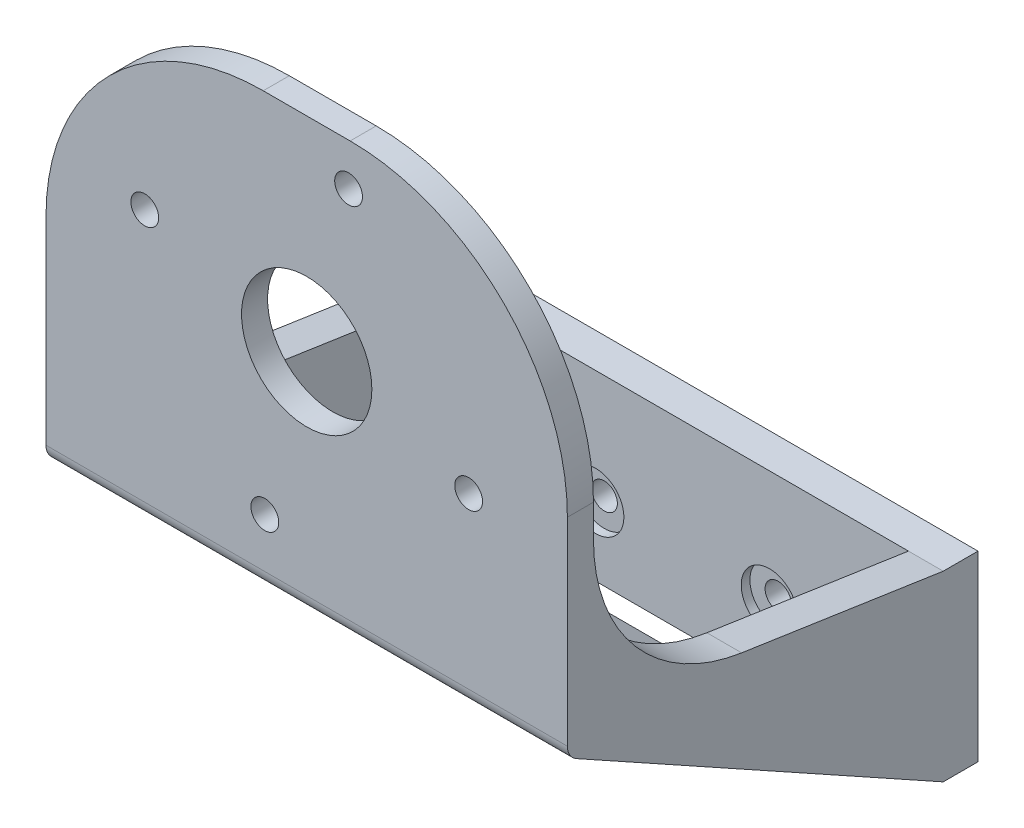
from build123d import *

# Parameters (mm, degrees)
SKETCH_1_R          = 1.4999999999999987
EXTRUDE_1_DEPTH     = 4
SKETCH_3_R          = 3.2499999999999996
SKETCH_3_R_2        = 3.249999999999999
CUT_EXTRUDE_1_DEPTH = 1
EXTRUDE_2_DEPTH     = 4
EXTRUDE_3_DEPTH     = 4
EXTRUDE_4_DEPTH     = 52
FILLET_1_R          = 25
FILLET_2_R          = 20
EXTRUDE_6_DEPTH     = 52
FILLET_4_R          = 6
FILLET_5_R          = 2
SKETCH_11_R         = 7.500000000000031
CUT_EXTRUDE_2_DEPTH = 4
FILLET_6_R          = 2


with BuildPart() as part:
    # 草图1 → 凸台-拉伸1 (new body)
    # profile 1 of 3: a face of its own
    with BuildSketch(Plane.XY):
        Polygon((30.00000000000006, 4.99999999999999), (30.000000000000057, -5.0000000000000115), (-29.99999999999994, -5.0000000000000115), (-29.999999999999936, 4.99999999999999), align=None)
        with Locations((9.999999999999996, 5.68e-15)):
            Circle(SKETCH_1_R, mode=Mode.SUBTRACT)
        with Locations((-10.000000000000004, -4.4e-16)):
            Circle(SKETCH_1_R, mode=Mode.SUBTRACT)
    # profile 2 of 3: a face of its own
    with BuildSketch(Plane.XY):
        Polygon((-30.000000000000014, 12.999999999999998), (29.999999999999986, 12.999999999999998), (30.00000000000006, 4.99999999999999), (-29.999999999999936, 4.99999999999999), align=None)
    # profile 3 of 3: a face of its own
    with BuildSketch(Plane.XY):
        Polygon((-29.99999999999994, -5.0000000000000115), (-30.000000000000018, -8.000000000000002), (29.999999999999982, -8.000000000000002), (30.000000000000057, -5.0000000000000115), align=None)
    extrude(amount=EXTRUDE_1_DEPTH)

    # 草图3 → 切除-拉伸1 (cut)
    with BuildSketch(Plane.XY.offset(4)):
        with Locations((-10.000000000000004, -4.6e-16)):
            Circle(SKETCH_3_R)
        with Locations((9.999999999999996, 5.69e-15)):
            Circle(SKETCH_3_R_2)
    extrude(amount=-CUT_EXTRUDE_1_DEPTH, mode=Mode.SUBTRACT)

    # 草图5 → 凸台-拉伸2 (add)
    with BuildSketch(Plane.ZY.offset(29.999999999999936)):
        Polygon((47.25000000000001, 15.99999999999999), (4, -8.000000000000012), (4, 12.999999999999988), (44.25, 18.99999999999999), (44.25, 64.99999999999999), (47.25, 64.99999999999999), align=None)
    extrude(amount=-EXTRUDE_2_DEPTH)

    # 草图6 → 凸台-拉伸3 (add)
    with BuildSketch(Plane(origin=(30.00000000000006, -1.041e-14, 0), x_dir=(0, 0, -1), z_dir=(1, -3.5e-16, 0))):
        Polygon((-44.25, 64.99999999999999), (-47.25, 64.99999999999999), (-47.25000000000001, 15.99999999999999), (-4, -8.00000000000001), (-4, 13.000000000000009), (-44.25, 18.999999999999993), align=None)
    extrude(amount=-EXTRUDE_3_DEPTH)

    # 草图7 → 凸台-拉伸4 (add)
    with BuildSketch(Plane(origin=(-25.999999999999932, 8.47e-15, 0), x_dir=(0, 0, -1), z_dir=(1, -3.3e-16, 0))):
        Polygon((-44.25, 14.335260115606923), (-44.25, 18.999999999999993), (-44.25, 64.99999999999999), (-47.25, 64.99999999999999), (-47.25000000000001, 15.999999999999986), align=None)
    extrude(amount=EXTRUDE_4_DEPTH)

    # 圆角1
    fillet_1_edges = [part.edges().sort_by_distance(p)[0] for p in [
        (-29.999999999999915, 65, 45.75),
        (30.00000000000008, 64.99999999999997, 45.75),
    ]]
    fillet(fillet_1_edges, radius=FILLET_1_R)

    # 圆角2
    fillet_2_edges = [part.edges().sort_by_distance(p)[0] for p in [
        (-27.99999999999993, 19, 44.25),
        (28.000000000000068, 18.999999999999982, 44.25),
    ]]
    fillet(fillet_2_edges, radius=FILLET_2_R)

    # 草图9 → 凸台-拉伸6 (add)
    with BuildSketch(Plane(origin=(-25.999999999999932, 8.47e-15, 0), x_dir=(0, 0, -1), z_dir=(1, -3.3e-16, 0))):
        Polygon((-33.14820415728187, 11.605667405253392), (-34.60384535674384, 8.982480660389633), (-17.11593372431879, -0.7217940026901655), (-17.115933724318786, 2.7091473962102923), align=None)
    extrude(amount=EXTRUDE_6_DEPTH)

    # 圆角4
    fillet_4_edges = [part.edges().sort_by_distance(p)[0] for p in [
        (-25.99999999999993, 10.294074032821522, 33.87602475701286),
        (26.00000000000007, 10.294074032821504, 33.87602475701286),
    ]]
    fillet(fillet_4_edges, radius=FILLET_4_R)

    # 圆角5
    fillet_5_edges = [part.edges().sort_by_distance(p)[0] for p in [
        (6.75e-14, -0.721794002690165, 17.11593372431879),
    ]]
    fillet(fillet_5_edges, radius=FILLET_5_R)

    # 草图11 → 切除-拉伸2 (cut)
    with BuildSketch(Plane.XY.offset(47.25000000000001)):
        with BuildLine():
            ThreePointArc((-20.11504932930021, 46.93210856983418), (-19.24913556906646, 44.8416078260319), (-17.158634825264187, 45.70752158626565))
            ThreePointArc((-17.158634825264187, 45.70752158626565), (-18.024548585497932, 47.79802233006792), (-20.11504932930021, 46.93210856983418))
        make_face()
        with BuildLine():
            ThreePointArc((-4.207521586267032, 24.341365174733916), (-6.298022330069304, 23.475451414500167), (-5.432108569835557, 21.384950670697894))
            ThreePointArc((-5.432108569835557, 21.384950670697894), (-3.341607826033282, 22.250864430931642), (-4.207521586267032, 24.341365174733916))
        make_face()
        with BuildLine():
            ThreePointArc((20.11504932930082, 36.06789143016255), (19.24913556906707, 38.158392173964835), (17.158634825264798, 37.292478413731075))
            ThreePointArc((17.158634825264798, 37.292478413731075), (18.024548585498543, 35.20197766992881), (20.11504932930082, 36.06789143016255))
        make_face()
        with BuildLine():
            ThreePointArc((5.43210856983612, 61.61504932929888), (3.341607826033848, 60.74913556906513), (4.207521586267595, 58.65863482526286))
            ThreePointArc((4.207521586267595, 58.65863482526286), (6.298022330069867, 59.5245485854966), (5.43210856983612, 61.61504932929888))
        make_face()
        with Locations((2.6021e-13, 41.49999999999841)):
            Circle(SKETCH_11_R)
    extrude(amount=-CUT_EXTRUDE_2_DEPTH, mode=Mode.SUBTRACT)

    # 圆角6
    fillet_6_edges = [part.edges().sort_by_distance(p)[0] for p in [
        (7.105e-14, 15.99999999999999, 47.25000000000001),
    ]]
    fillet(fillet_6_edges, radius=FILLET_6_R)


solid = part.part
